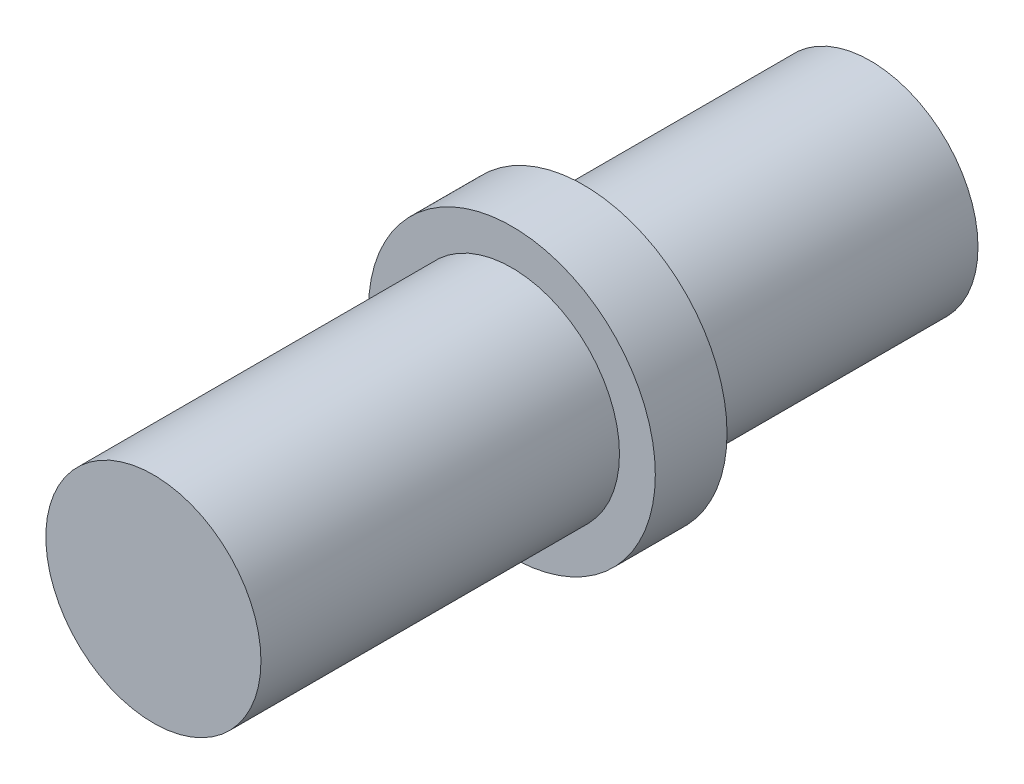
from build123d import *

# Parameters (mm, degrees)
SKETCH2_R              = 3
LOCATOR_SHAFT_DEPTH    = 20
LOCATOR_SHOULDER_START = 8
SKETCH3_R              = 4
LOCATOR_SHOULDER_DEPTH = 2


with BuildPart() as part:
    # Sketch2 → Locator_shaft (new body)
    with BuildSketch(Plane.XY):
        Circle(SKETCH2_R)
    extrude(amount=LOCATOR_SHAFT_DEPTH)

    # Sketch3 → Locator_shoulder (add)
    with BuildSketch(Plane.XY.offset(LOCATOR_SHOULDER_START)):
        Circle(SKETCH3_R)
    extrude(amount=LOCATOR_SHOULDER_DEPTH)


solid = part.part
